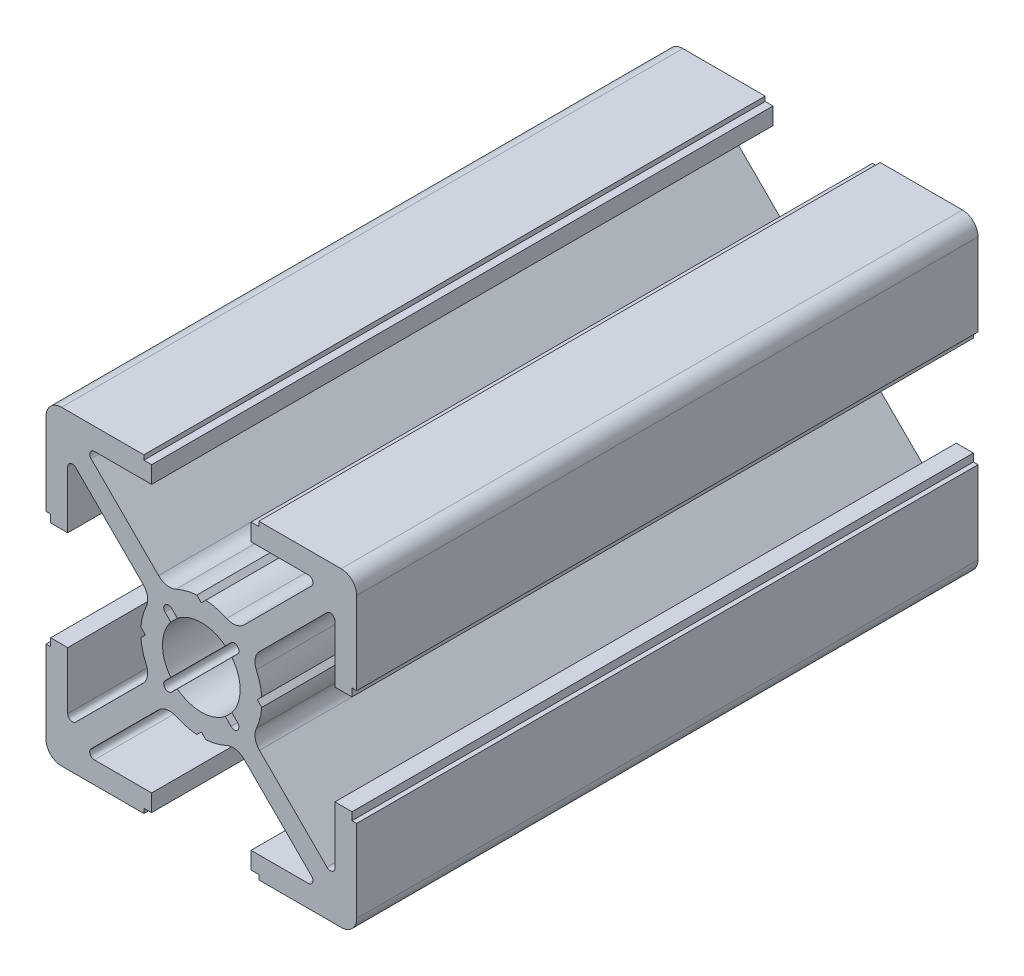
from build123d import *

# Parameters (mm, degrees)
Y_KSEKLIK_EKSTR_ZYON1_DEPTH = 40
RADYUS1_R                   = 1
RADYUS2_R                   = 0.3
RADYUS3_R                   = 1


with BuildPart() as part:
    # Çizim1 → Yükseklik-Ekstrüzyon1 (new body)
    with BuildSketch(Plane.XY):
        with BuildLine():
            Line((-8.6, -3.2), (-9.7, -3.2))
            Line((-9.7, -3.2), (-9.7, -3.7))
            Line((-9.7, -3.7), (-10, -3.7))
            Line((-10, -3.7), (-10, -10))
            Line((-10, -10), (-3.7, -10))
            Line((-3.7, -10), (-3.7, -9.7))
            Line((-3.7, -9.7), (-3.2, -9.7))
            Line((-3.2, -9.7), (-3.2, -8.6))
            Line((-3.2, -8.6), (-7.610050506, -8.6))
            Line((-7.610050506, -8.6), (-2.217957246, -3.20790674))
            ThreePointArc((-2.217957246, -3.20790674), (-1.299073648, -3.677282646), (-0.289258242, -3.889258242))
            Line((-0.289258242, -3.889258242), (0, -3.6))
            Line((0, -3.6), (0.289258242, -3.889258242))
            ThreePointArc((0.289258242, -3.889258242), (1.299073648, -3.677282646), (2.217957246, -3.20790674))
            Line((2.217957246, -3.20790674), (7.610050506, -8.6))
            Line((7.610050506, -8.6), (3.2, -8.6))
            Line((3.2, -8.6), (3.2, -9.7))
            Line((3.2, -9.7), (3.7, -9.7))
            Line((3.7, -9.7), (3.7, -10))
            Line((3.7, -10), (10, -10))
            Line((10, -10), (10, -3.7))
            Line((10, -3.7), (9.7, -3.7))
            Line((9.7, -3.7), (9.7, -3.2))
            Line((9.7, -3.2), (8.6, -3.2))
            Line((8.6, -3.2), (8.6, -7.610050506))
            Line((8.6, -7.610050506), (3.20790674, -2.217957246))
            ThreePointArc((3.20790674, -2.217957246), (3.677282646, -1.299073648), (3.889258242, -0.289258242))
            Line((3.889258242, -0.289258242), (3.6, 0))
            Line((3.6, 0), (3.889258242, 0.289258242))
            ThreePointArc((3.889258242, 0.289258242), (3.677282646, 1.299073648), (3.20790674, 2.217957246))
            Line((3.20790674, 2.217957246), (8.6, 7.610050506))
            Line((8.6, 7.610050506), (8.6, 3.2))
            Line((8.6, 3.2), (9.7, 3.2))
            Line((9.7, 3.2), (9.7, 3.7))
            Line((9.7, 3.7), (10, 3.7))
            Line((10, 3.7), (10, 10))
            Line((10, 10), (3.7, 10))
            Line((3.7, 10), (3.7, 9.7))
            Line((3.7, 9.7), (3.2, 9.7))
            Line((3.2, 9.7), (3.2, 8.6))
            Line((3.2, 8.6), (7.610050506, 8.6))
            Line((7.610050506, 8.6), (2.217957246, 3.20790674))
            ThreePointArc((2.217957246, 3.20790674), (1.299073648, 3.677282646), (0.289258242, 3.889258242))
            Line((0.289258242, 3.889258242), (0, 3.6))
            Line((0, 3.6), (-0.289258242, 3.889258242))
            ThreePointArc((-0.289258242, 3.889258242), (-1.299073648, 3.677282646), (-2.217957246, 3.20790674))
            Line((-2.217957246, 3.20790674), (-7.610050506, 8.6))
            Line((-7.610050506, 8.6), (-3.2, 8.6))
            Line((-3.2, 8.6), (-3.2, 9.7))
            Line((-3.2, 9.7), (-3.7, 9.7))
            Line((-3.7, 9.7), (-3.7, 10))
            Line((-3.7, 10), (-10, 10))
            Line((-10, 10), (-10, 3.7))
            Line((-10, 3.7), (-9.7, 3.7))
            Line((-9.7, 3.7), (-9.7, 3.2))
            Line((-9.7, 3.2), (-8.6, 3.2))
            Line((-8.6, 3.2), (-8.6, 7.610050506))
            Line((-8.6, 7.610050506), (-3.20790674, 2.217957246))
            ThreePointArc((-3.20790674, 2.217957246), (-3.677282646, 1.299073648), (-3.889258242, 0.289258242))
            Line((-3.889258242, 0.289258242), (-3.6, 0))
            Line((-3.6, 0), (-3.889258242, -0.289258242))
            ThreePointArc((-3.889258242, -0.289258242), (-3.677282646, -1.299073648), (-3.20790674, -2.217957246))
            Line((-3.20790674, -2.217957246), (-8.6, -7.610050506))
            Line((-8.6, -7.610050506), (-8.6, -3.2))
        make_face()
        with BuildLine():
            Line((1.967124912, -1.542860843), (2.333452378, -1.909188309))
            ThreePointArc((2.333452378, -1.909188309), (2.333452378, -2.333452378), (1.909188309, -2.333452378))
            Line((1.909188309, -2.333452378), (1.542860843, -1.967124912))
            ThreePointArc((1.542860843, -1.967124912), (0, -2.5), (-1.542860843, -1.967124912))
            Line((-1.542860843, -1.967124912), (-1.909188309, -2.333452378))
            ThreePointArc((-1.909188309, -2.333452378), (-2.333452378, -2.333452378), (-2.333452378, -1.909188309))
            Line((-2.333452378, -1.909188309), (-1.967124912, -1.542860843))
            ThreePointArc((-1.967124912, -1.542860843), (-2.5, 0), (-1.967124912, 1.542860843))
            Line((-1.967124912, 1.542860843), (-2.333452378, 1.909188309))
            ThreePointArc((-2.333452378, 1.909188309), (-2.333452378, 2.333452378), (-1.909188309, 2.333452378))
            Line((-1.909188309, 2.333452378), (-1.542860843, 1.967124912))
            ThreePointArc((-1.542860843, 1.967124912), (0, 2.5), (1.542860843, 1.967124912))
            Line((1.542860843, 1.967124912), (1.909188309, 2.333452378))
            ThreePointArc((1.909188309, 2.333452378), (2.333452378, 2.333452378), (2.333452378, 1.909188309))
            Line((2.333452378, 1.909188309), (1.967124912, 1.542860843))
            ThreePointArc((1.967124912, 1.542860843), (2.5, 0), (1.967124912, -1.542860843))
        make_face(mode=Mode.SUBTRACT)
    extrude(amount=Y_KSEKLIK_EKSTR_ZYON1_DEPTH)

    # Radyus1
    radyus1_edges = [part.edges().sort_by_distance(p)[0] for p in [
        (-2.217957246, -3.20790674, 20),
        (-3.20790674, -2.217957246, 20),
        (-3.20790674, 2.217957246, 20),
        (-2.217957246, 3.20790674, 20),
        (2.217957246, 3.20790674, 20),
        (3.20790674, 2.217957246, 20),
        (3.20790674, -2.217957246, 20),
        (2.217957246, -3.20790674, 20),
    ]]
    fillet(radyus1_edges, radius=RADYUS1_R)

    # Radyus2
    radyus2_edges = [part.edges().sort_by_distance(p)[0] for p in [
        (-7.610050506, -8.6, 20),
        (-8.6, -7.610050506, 20),
        (-8.6, 7.610050506, 20),
        (-7.610050506, 8.6, 20),
        (7.610050506, 8.6, 20),
        (8.6, 7.610050506, 20),
        (8.6, -7.610050506, 20),
        (7.610050506, -8.6, 20),
    ]]
    fillet(radyus2_edges, radius=RADYUS2_R)

    # Radyus3
    radyus3_edges = [part.edges().sort_by_distance(p)[0] for p in [
        (-10, -10, 20),
        (-10, 10, 20),
        (10, 10, 20),
        (10, -10, 20),
    ]]
    fillet(radyus3_edges, radius=RADYUS3_R)


solid = part.part
